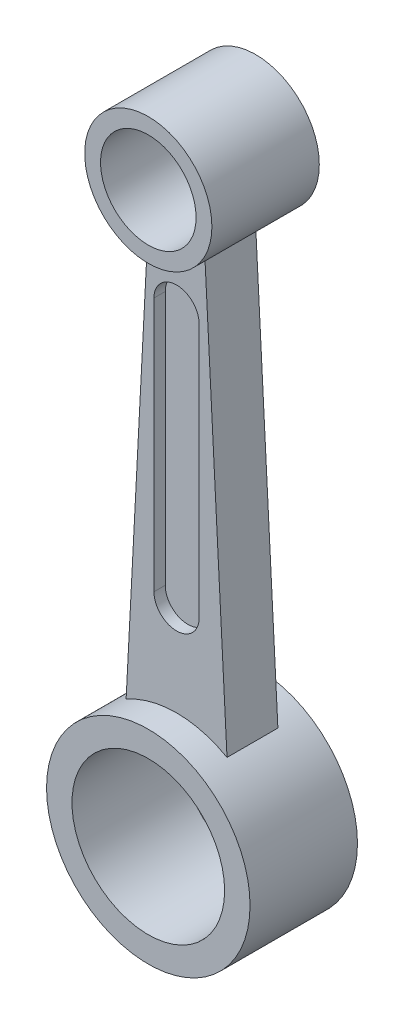
from build123d import *

# Parameters (mm, degrees)
SKETCH1_R             = 22.5
SKETCH1_R_2           = 16.9
BOSS_EXTRUDE1_DEPTH   = 19
SKETCH1_R_3           = 36
SKETCH1_R_4           = 27
BOSS_EXTRUDE1_2_DEPTH = 19
BOSS_EXTRUDE2_DEPTH   = 9
CUT_EXTRUDE1_DEPTH    = 4


with BuildPart() as part:
    # Sketch1 → Boss-Extrude1 (new, symmetric)
    with BuildSketch(Plane.XY):
        Circle(SKETCH1_R)
        Circle(SKETCH1_R_2, mode=Mode.SUBTRACT)
    extrude(amount=BOSS_EXTRUDE1_DEPTH, both=True)



with BuildPart() as body_2:
    # Sketch1 → Boss-Extrude1 2 (new, symmetric)
    with BuildSketch(Plane.XY):
        with Locations((0, -201.2)):
            Circle(SKETCH1_R_3)
        with Locations((0, -201.2)):
            Circle(SKETCH1_R_4, mode=Mode.SUBTRACT)
    extrude(amount=BOSS_EXTRUDE1_2_DEPTH, both=True)


with BuildPart() as part_1:
    add(part.part)

    add(body_2.part)  # Boss-Extrude2 merges body 2
    # Sketch1<3> → Boss-Extrude2 (add, symmetric)
    with BuildSketch(Plane.XY):
        with BuildLine():
            ThreePointArc((10, -20.155644371), (0, -22.5), (-10, -20.155644371))
            Line((-10, -20.155644371), (-17.849697213, -169.936789841))
            ThreePointArc((-17.849697213, -169.936789841), (0, -165.2), (17.849697213, -169.936789841))
            Line((17.849697213, -169.936789841), (10, -20.155644371))
        make_face()
    extrude(amount=BOSS_EXTRUDE2_DEPTH, both=True)

    # Sketch2 → Cut-Extrude1 (cut)
    with BuildSketch(Plane.XY.offset(9)):
        with BuildLine():
            Line((-8, -132.1), (-8, -42.1))
            ThreePointArc((-8, -42.1), (0, -34.1), (8, -42.1))
            Line((8, -42.1), (8, -132.1))
            ThreePointArc((8, -132.1), (0, -140.1), (-8, -132.1))
        make_face()
    cut_extrude1 = extrude(amount=-CUT_EXTRUDE1_DEPTH, mode=Mode.SUBTRACT)

    # Mirror1: Cut-Extrude1 across plane
    add(cut_extrude1.mirror(Plane.XY), mode=Mode.SUBTRACT)


solid = part_1.part
